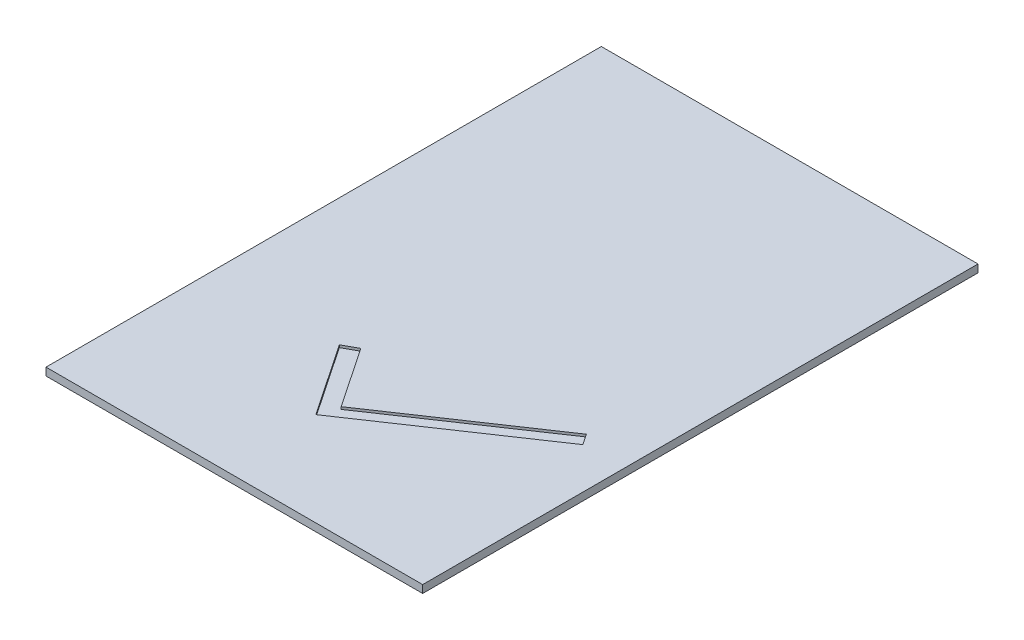
from build123d import *

# Parameters (mm, degrees)
SKETCH1_W           = 78
SKETCH1_H           = 115
BOSS_EXTRUDE1_DEPTH = 1.6
CUT_EXTRUDE1_DEPTH  = 0.5


with BuildPart() as part:
    # Sketch1 → Boss-Extrude1 (new body)
    with BuildSketch(Plane(origin=(0, 0, 0), x_dir=(1, 0, 0), z_dir=(0, 1, 0))):
        with Locations((39, 57.5)):
            Rectangle(SKETCH1_W, SKETCH1_H)
    extrude(amount=BOSS_EXTRUDE1_DEPTH)

    # Sketch2 → Cut-Extrude1 (cut)
    with BuildSketch(Plane(origin=(0, 1.6, 0), x_dir=(1, 0, 0), z_dir=(0, 1, 0))):
        Polygon((29.2391116, 35.954624385), (37.64825193, 23.476545185), (67.98571545, 43.921357557), (69.49437183, 41.682706154), (36.455578557, 19.417432427), (26.37948086, 34.369061269), align=None)
    extrude(amount=-CUT_EXTRUDE1_DEPTH, mode=Mode.SUBTRACT)


solid = part.part
